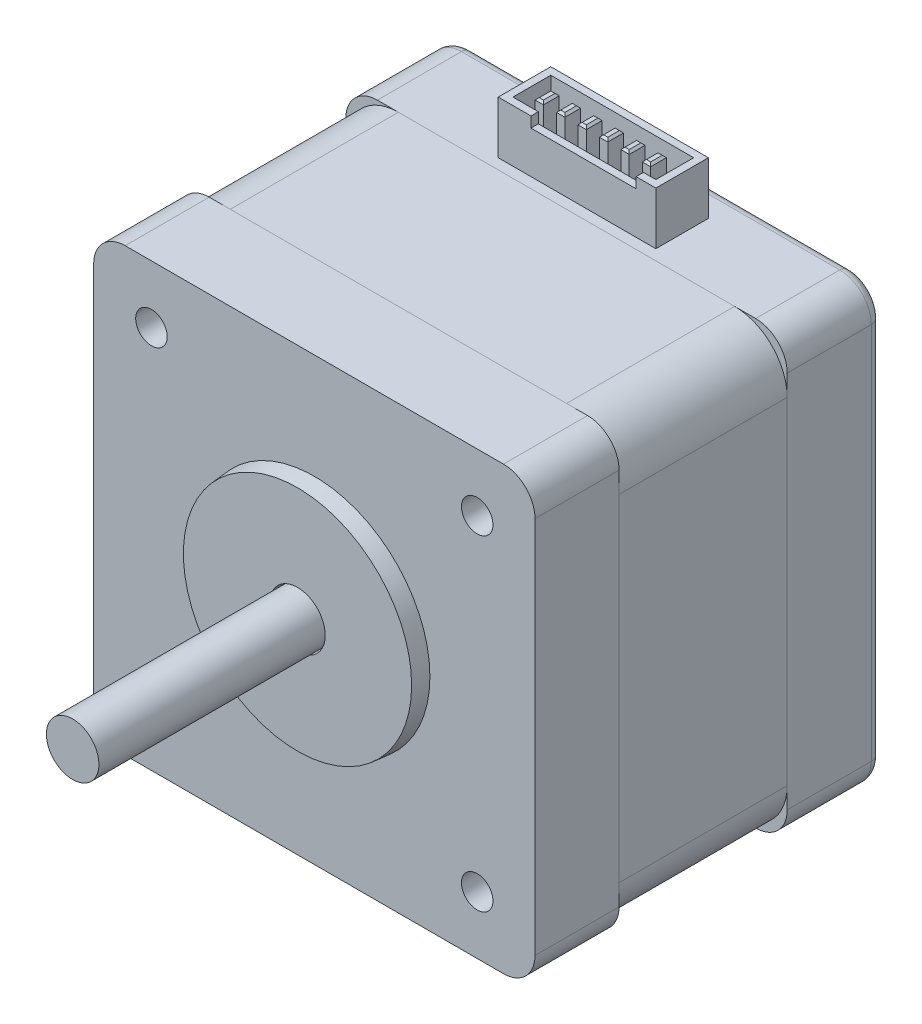
from build123d import *

# Parameters (mm, degrees)
SKETCH_1_R          = 1.5
EXTRUDE_1_DEPTH     = 8
SKETCH_4_R          = 2.5
EXTRUDE_2_DEPTH     = 23
SKETCH_9_W          = 42
SKETCH_9_H          = 42
EXTRUDE_7_DEPTH     = 16
SKETCH_10_W         = 42
SKETCH_10_H         = 42
EXTRUDE_8_DEPTH     = 9
FILLET_1_R          = 3
FILLET_2_R          = 5
SKETCH_14_W         = 15
SKETCH_14_H         = 5
SKETCH_14_W_2       = 13.6
SKETCH_14_H_2       = 3.6
SKETCH_14_W_3       = 0.8
SKETCH_14_H_3       = 1.5
EXTRUDE_10_DEPTH    = 5
CHAMFER_1_SIZE      = 0.2
SKETCH_15_W         = 10
SKETCH_15_H         = 1
CUT_EXTRUDE_2_DEPTH = 0.7
FILLET_3_R          = 1
SKETCH_16_R         = 11
SKETCH_16_R_2       = 2.5
EXTRUDE_11_DEPTH    = 1.6
EXTRUDE_11_DRAFT    = 5


with BuildPart() as part:
    # 草图1 → 凸台-拉伸1 (new body)
    with BuildSketch(Plane.XY):
        with BuildLine():
            Line((-18, 21), (18, 21))
            ThreePointArc((18, 21), (20.121320344, 20.121320344), (21, 18))
            Line((21, 18), (21, -18))
            ThreePointArc((21, -18), (20.121320344, -20.121320344), (18, -21))
            Line((18, -21), (-18, -21))
            ThreePointArc((-18, -21), (-20.121320344, -20.121320344), (-21, -18))
            Line((-21, -18), (-21, 18))
            ThreePointArc((-21, 18), (-20.121320344, 20.121320344), (-18, 21))
        make_face()
        with Locations((-15.5, 15.5)):
            Circle(SKETCH_1_R, mode=Mode.SUBTRACT)
        with Locations(Location((15.5, 15.5, 0), (0, 0, 180))):
            Circle(SKETCH_1_R, mode=Mode.SUBTRACT)
        with Locations((15.5, -15.5)):
            Circle(SKETCH_1_R, mode=Mode.SUBTRACT)
        with Locations(Location((-15.5, -15.5, 0), (0, 0, 180))):
            Circle(SKETCH_1_R, mode=Mode.SUBTRACT)
    extrude(amount=EXTRUDE_1_DEPTH)

    # 草图4 → 凸台-拉伸2 (add)
    with BuildSketch(Plane.XY.offset(8)):
        with Locations(Location((0, 0, 0), (0, 0, 180))):
            Circle(SKETCH_4_R)
    extrude(amount=EXTRUDE_2_DEPTH)


with BuildPart() as body_2:
    # 草图9 → 凸台-拉伸7 (new body)
    with BuildSketch(Plane(origin=(0, 0, 0), x_dir=(-1, 0, 0), z_dir=(0, 0, -1))):
        Rectangle(SKETCH_9_W, SKETCH_9_H)
    extrude(amount=EXTRUDE_7_DEPTH)

    # 圆角2
    fillet_2_edges = [body_2.edges().sort_by_distance(p)[0] for p in [
        (-21, -21, -8),
        (21, -21, -8),
        (21, 21, -8),
        (-21, 21, -8),
    ]]
    fillet(fillet_2_edges, radius=FILLET_2_R)


with BuildPart() as body_3:
    # 草图10 → 凸台-拉伸8 (new body)
    with BuildSketch(Plane(origin=(0, 0, -16), x_dir=(-1, 0, 0), z_dir=(0, 0, -1))):
        Rectangle(SKETCH_10_W, SKETCH_10_H)
    extrude(amount=EXTRUDE_8_DEPTH)

    # 圆角1
    fillet_1_edges = [body_3.edges().sort_by_distance(p)[0] for p in [
        (21, 21, -20.5),
        (-21, 21, -20.5),
        (-21, -21, -20.5),
        (21, -21, -20.5),
    ]]
    fillet(fillet_1_edges, radius=FILLET_1_R)

    # 草图14 → 凸台-拉伸10 (add)
    # profile 1 of 7: a face of its own
    with BuildSketch(Plane(origin=(0, 21, 0), x_dir=(1, 0, 0), z_dir=(0, 1, 0))):
        with Locations((0, 19.5)):
            Rectangle(SKETCH_14_W, SKETCH_14_H)
        with Locations((0, 19.5)):
            Rectangle(SKETCH_14_W_2, SKETCH_14_H_2, mode=Mode.SUBTRACT)
    # profile 2 of 7: a face of its own
    with BuildSketch(Plane(origin=(0, 21, 0), x_dir=(1, 0, 0), z_dir=(0, 1, 0))):
        with Locations((-5.3, 19.457329348)):
            Rectangle(SKETCH_14_W_3, SKETCH_14_H_3)
    # profile 3 of 7: a face of its own
    with BuildSketch(Plane(origin=(0, 21, 0), x_dir=(1, 0, 0), z_dir=(0, 1, 0))):
        with Locations((-1.22, 19.457329348)):
            Rectangle(SKETCH_14_W_3, SKETCH_14_H_3)
    # profile 4 of 7: a face of its own
    with BuildSketch(Plane(origin=(0, 21, 0), x_dir=(1, 0, 0), z_dir=(0, 1, 0))):
        with Locations((4.9, 19.457329348)):
            Rectangle(SKETCH_14_W_3, SKETCH_14_H_3)
    # profile 5 of 7: a face of its own
    with BuildSketch(Plane(origin=(0, 21, 0), x_dir=(1, 0, 0), z_dir=(0, 1, 0))):
        with Locations((2.86, 19.457329348)):
            Rectangle(SKETCH_14_W_3, SKETCH_14_H_3)
    # profile 6 of 7: a face of its own
    with BuildSketch(Plane(origin=(0, 21, 0), x_dir=(1, 0, 0), z_dir=(0, 1, 0))):
        with Locations((-3.26, 19.457329348)):
            Rectangle(SKETCH_14_W_3, SKETCH_14_H_3)
    # profile 7 of 7: a face of its own
    with BuildSketch(Plane(origin=(0, 21, 0), x_dir=(1, 0, 0), z_dir=(0, 1, 0))):
        with Locations((0.82, 19.457329348)):
            Rectangle(SKETCH_14_W_3, SKETCH_14_H_3)
    extrude(amount=EXTRUDE_10_DEPTH)

    # 倒角1
    chamfer_1_edges = [body_3.edges().sort_by_distance(p)[0] for p in [
        (-2.86, 26, -19.457329348),
        (-3.26, 26, -20.207329348),
        (-3.66, 26, -19.457329348),
        (-3.26, 26, -18.707329348),
        (1.22, 26, -19.457329348),
        (0.82, 26, -20.207329348),
        (0.42, 26, -19.457329348),
        (0.82, 26, -18.707329348),
        (-4.9, 26, -19.457329348),
        (-5.3, 26, -20.207329348),
        (-5.7, 26, -19.457329348),
        (-5.3, 26, -18.707329348),
        (-0.82, 26, -19.457329348),
        (-1.22, 26, -20.207329348),
        (-1.62, 26, -19.457329348),
        (-1.22, 26, -18.707329348),
        (5.3, 26, -19.457329348),
        (4.9, 26, -20.207329348),
        (4.5, 26, -19.457329348),
        (4.9, 26, -18.707329348),
        (3.26, 26, -19.457329348),
        (2.86, 26, -20.207329348),
        (2.46, 26, -19.457329348),
        (2.86, 26, -18.707329348),
    ]]
    chamfer(chamfer_1_edges, length=CHAMFER_1_SIZE)

    # 草图15 → 切除-拉伸2 (cut)
    with BuildSketch(Plane.XY.offset(-17)):
        with Locations((0.62, 25.5)):
            Rectangle(SKETCH_15_W, SKETCH_15_H)
    extrude(amount=-CUT_EXTRUDE_2_DEPTH, mode=Mode.SUBTRACT)

    # 圆角3
    fillet_3_edges = [body_3.edges().sort_by_distance(p)[0] for p in [
        (0, -21, -25),
        (21, 0, -25),
        (-21, 0, -25),
        (0, 21, -25),
        (20.121320344, 20.121320344, -25),
        (-20.121320344, 20.121320344, -25),
        (-20.121320344, -20.121320344, -25),
        (20.121320344, -20.121320344, -25),
    ]]
    fillet(fillet_3_edges, radius=FILLET_3_R)


with BuildPart() as extrude_11_tool:
    # 草图16 → 凸台-拉伸11 (with draft: the straight prism first)
    with BuildSketch(Plane.XY.offset(8)):
        Circle(SKETCH_16_R)
        Circle(SKETCH_16_R_2, mode=Mode.SUBTRACT)
    extrude(amount=EXTRUDE_11_DEPTH)
    # 凸台-拉伸11: the draft: its side faces are tilted about the plane it starts from
    extrude_11_sides = [extrude_11_tool.faces().sort_by_distance(p)[0] for p in [
        (-11, 0, 8.8),
        (-2.5, 0, 8.8),
    ]]
    draft(extrude_11_sides, Plane.XY.offset(8), EXTRUDE_11_DRAFT)


with BuildPart() as part_1:
    add(part.part)

    # 凸台-拉伸11: add extrude_11_tool
    add(extrude_11_tool.part)


solid = Compound([body_2.part, body_3.part, part_1.part])
